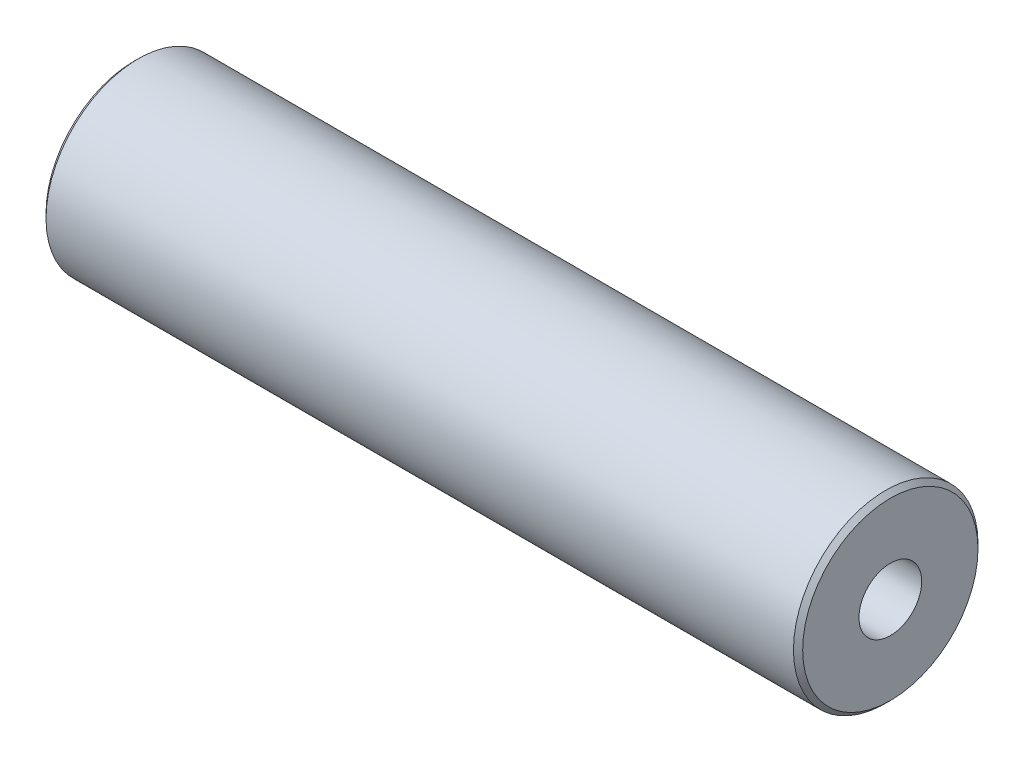
from build123d import *

# Parameters (mm, degrees)
SKETCH1_R             = 10
BOSS_EXTRUDE1_DEPTH   = 41
CHAMFER1_SIZE         = 0.5
M8_TAPPED_HOLE1_D     = 6.8
M8_TAPPED_HOLE1_DEPTH = 22.25
M8_TAPPED_HOLE1_TIP   = 2.042926105
M8_TAPPED_HOLE2_D     = 6.8
M8_TAPPED_HOLE2_DEPTH = 22.25
M8_TAPPED_HOLE2_TIP   = 2.042926105


with BuildPart() as part:
    # Sketch1 → Boss-Extrude1 (new, symmetric)
    with BuildSketch(Plane(origin=(0, 0, 0), x_dir=(0, 0, -1), z_dir=(1, 0, 0))):
        Circle(SKETCH1_R)
    extrude(amount=BOSS_EXTRUDE1_DEPTH, both=True)

    # Chamfer1
    chamfer1_edges = [part.edges().sort_by_distance(p)[0] for p in [
        (-41, 0, 10),
        (41, 0, 10),
    ]]
    chamfer(chamfer1_edges, length=CHAMFER1_SIZE)

    # M8 Tapped Hole1
    with Locations(Plane(origin=(41, 0, 0), x_dir=(0, 0, -1), z_dir=(1, 0, 0))):
        with Locations((0, 0)):
            Hole(M8_TAPPED_HOLE1_D / 2, depth=M8_TAPPED_HOLE1_DEPTH)
            with Locations((0, 0, -(M8_TAPPED_HOLE1_DEPTH + M8_TAPPED_HOLE1_TIP / 2))):  # 118° drill point
                Cone(0, M8_TAPPED_HOLE1_D / 2, M8_TAPPED_HOLE1_TIP, mode=Mode.SUBTRACT)

    # M8 Tapped Hole2
    with Locations(Plane.ZY.offset(41)):
        with Locations((0, 0)):
            Hole(M8_TAPPED_HOLE2_D / 2, depth=M8_TAPPED_HOLE2_DEPTH)
            with Locations((0, 0, -(M8_TAPPED_HOLE2_DEPTH + M8_TAPPED_HOLE2_TIP / 2))):  # 118° drill point
                Cone(0, M8_TAPPED_HOLE2_D / 2, M8_TAPPED_HOLE2_TIP, mode=Mode.SUBTRACT)


solid = part.part
